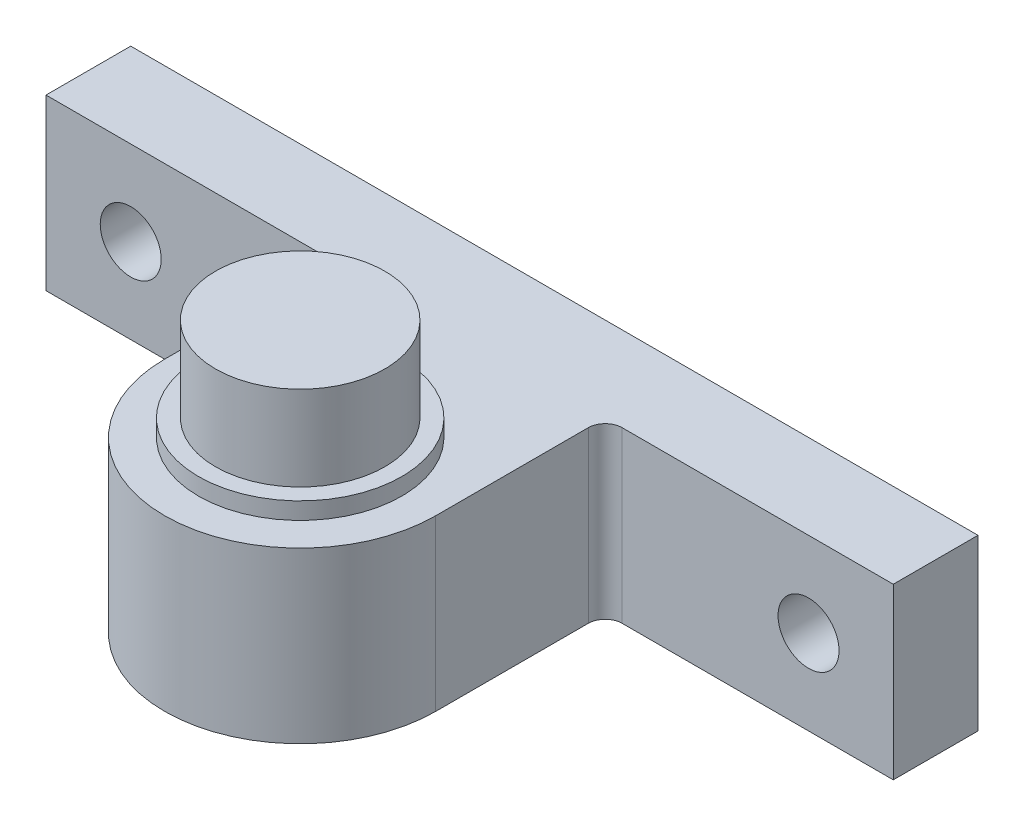
from build123d import *

# Parameters (mm, degrees)
EXTRUDE_1_DEPTH     = 10
SKETCH_2_R          = 5
EXTRUDE_2_DEPTH     = 6
SKETCH_3_R          = 6
EXTRUDE_3_DEPTH     = 1
SKETCH_4_R          = 1.8
CUT_EXTRUDE_1_DEPTH = 38.549966711
FILLET_1_R          = 1


with BuildPart() as part:
    # ｽｹｯﾁ1 → ﾎﾞｽ - 押し出し1 (new body)
    with BuildSketch(Plane(origin=(0, 0, 0), x_dir=(1, 0, 0), z_dir=(0, 1, 0))):
        with BuildLine():
            Line((-8, 0), (-8, 10))
            Line((-8, 10), (-25, 10))
            Line((-25, 10), (-25, 15))
            Line((-25, 15), (25, 15))
            Line((25, 15), (25, 10))
            Line((25, 10), (8, 10))
            Line((8, 10), (8, 0))
            ThreePointArc((8, 0), (0, -8), (-8, 0))
        make_face()
    extrude(amount=EXTRUDE_1_DEPTH)

    # ｽｹｯﾁ2 → ﾎﾞｽ - 押し出し2 (add)
    with BuildSketch(Plane(origin=(0, 10, 0), x_dir=(1, 0, 0), z_dir=(0, 1, 0))):
        with Locations(Location((0, 0, 0), (0, 0, 270))):
            Circle(SKETCH_2_R)
    extrude(amount=EXTRUDE_2_DEPTH)

    # ｽｹｯﾁ3 → ﾎﾞｽ - 押し出し3 (add)
    with BuildSketch(Plane(origin=(0, 10, 0), x_dir=(1, 0, 0), z_dir=(0, 1, 0))):
        with Locations(Location((0, 0, 0), (0, 0, 270))):
            Circle(SKETCH_3_R)
    extrude(amount=EXTRUDE_3_DEPTH)

    # ｽｹｯﾁ4 → ｶｯﾄ - 押し出し1 (cut, through all)
    with BuildSketch(Plane(origin=(0, 0, -15), x_dir=(-1, 0, 0), z_dir=(0, 0, -1))):
        with Locations((20, 5)):
            Circle(SKETCH_4_R)
        with Locations((-20, 5)):
            Circle(SKETCH_4_R)
    extrude(amount=-CUT_EXTRUDE_1_DEPTH, mode=Mode.SUBTRACT)

    # ﾌｨﾚｯﾄ1
    fillet_1_edges = [part.edges().sort_by_distance(p)[0] for p in [
        (-8, 5, -10),
        (8, 5, -10),
    ]]
    fillet(fillet_1_edges, radius=FILLET_1_R)


solid = part.part
